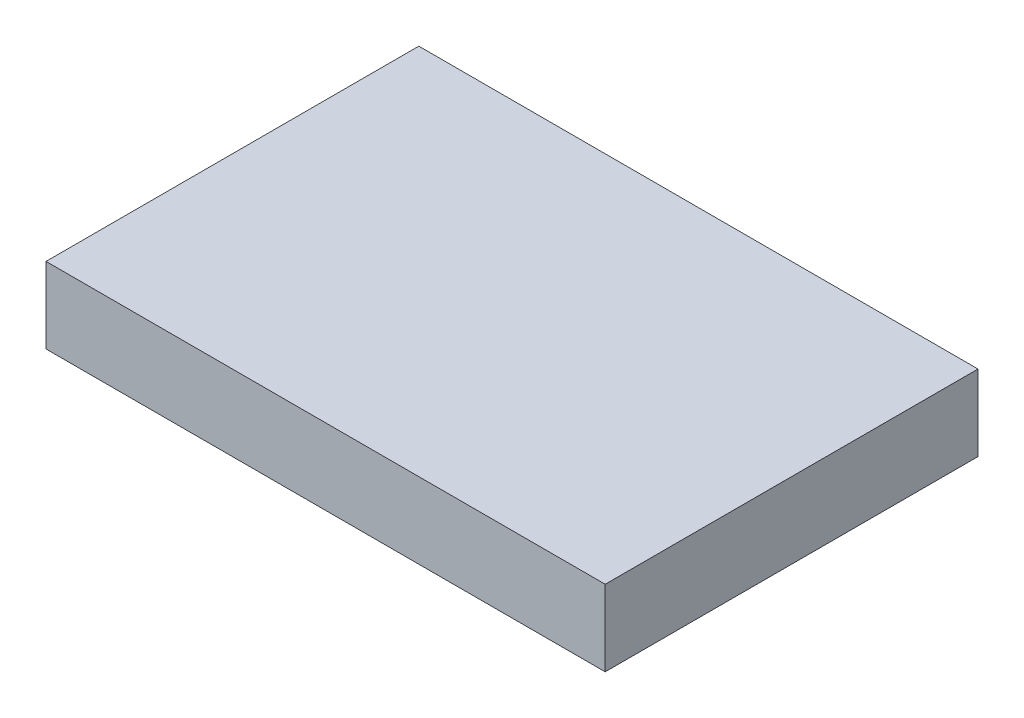
from build123d import *

# Parameters (mm, degrees)
SKETCH1_W           = 76.2
SKETCH1_H           = 50.8
BOSS_EXTRUDE1_DEPTH = 10.3378


with BuildPart() as part:
    # Sketch1 → Boss-Extrude1 (new body)
    with BuildSketch(Plane(origin=(0, 0, 0), x_dir=(1, 0, 0), z_dir=(0, 1, 0))):
        with Locations((38.1, 25.4)):
            Rectangle(SKETCH1_W, SKETCH1_H)
    extrude(amount=BOSS_EXTRUDE1_DEPTH)


solid = part.part
